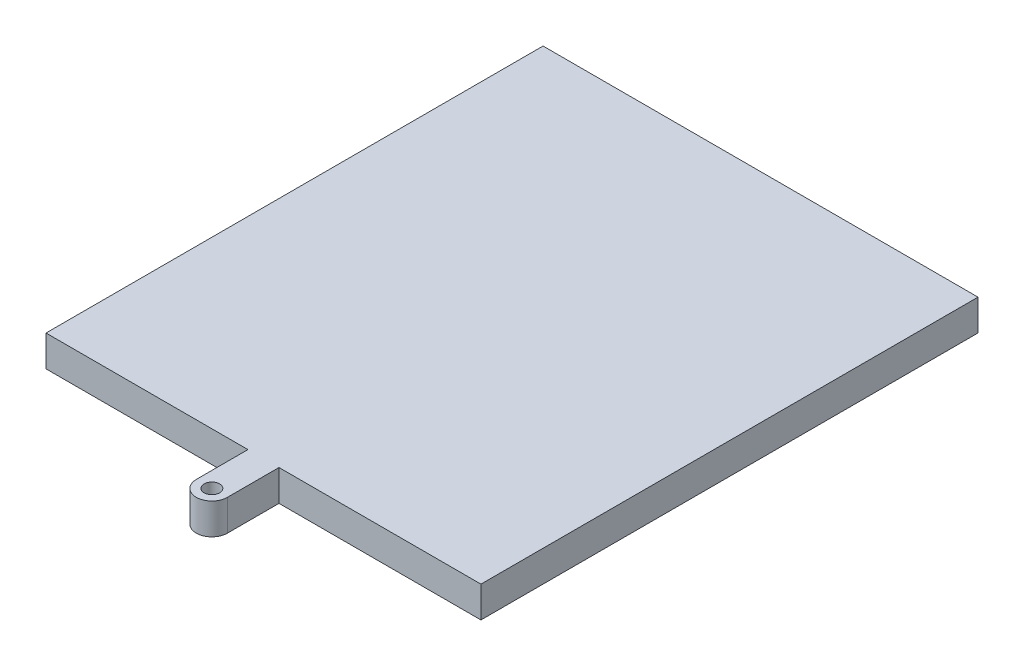
from build123d import *

# Parameters (mm, degrees)
SKETCH1_R           = 1.25
BOSS_EXTRUDE1_DEPTH = 5


with BuildPart() as part:
    # Sketch1 → Boss-Extrude1 (new body)
    with BuildSketch(Plane(origin=(0, 0, 0), x_dir=(1, 0, 0), z_dir=(0, 1, 0))):
        with BuildLine():
            Line((0, -80), (0, 0))
            Line((0, 0), (-70, 0))
            Line((-70, 0), (-70, -80))
            Line((-70, -80), (-37.5, -80))
            Line((-37.5, -80), (-37.5, -88.305370533))
            ThreePointArc((-37.5, -88.305370533), (-35, -90.805370533), (-32.5, -88.305370533))
            Line((-32.5, -88.305370533), (-32.5, -80))
            Line((-32.5, -80), (0, -80))
        make_face()
        with Locations((-35, -88.305370533)):
            Circle(SKETCH1_R, mode=Mode.SUBTRACT)
    extrude(amount=BOSS_EXTRUDE1_DEPTH)


solid = part.part
